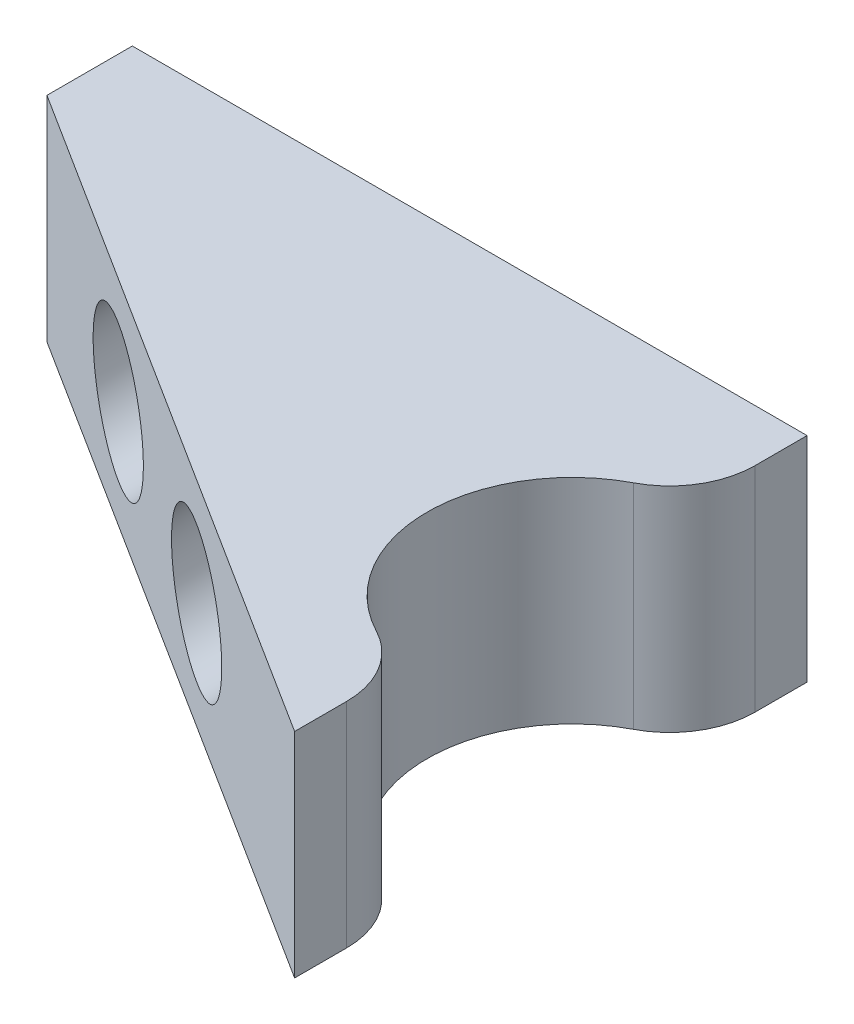
from build123d import *

# Parameters (mm, degrees)
SKETCH1_W           = 50.165
SKETCH1_H           = 15.875
SKETCH1_R           = 3.302
BOSS_EXTRUDE1_DEPTH = 6.35
BOSS_EXTRUDE2_DEPTH = 15.875
FILLET1_R           = 6.35
SKETCH1_3_R         = 3.302
CUT_EXTRUDE1_DEPTH  = 47.300601643
SKETCH10_R          = 5.08
CUT_EXTRUDE4_DEPTH  = 42.233459866


with BuildPart() as part:
    # Sketch1 → Boss-Extrude1 (new body)
    with BuildSketch(Plane.XY):
        Rectangle(SKETCH1_W, SKETCH1_H)
        with Locations((5.23875, 0)):
            Circle(SKETCH1_R, mode=Mode.SUBTRACT)
        with Locations((-10.63625, 0)):
            Circle(SKETCH1_R, mode=Mode.SUBTRACT)
    extrude(amount=BOSS_EXTRUDE1_DEPTH)

    # Sketch4 → Boss-Extrude2 (add, through all)
    with BuildSketch(Plane.XZ.offset(7.9375)):
        with BuildLine():
            Line((-25.0825, 6.35), (25.0825, 6.35))
            Line((25.0825, 6.35), (25.0825, 8.382))
            ThreePointArc((25.0825, 8.382), (15.884529206, 19.05), (25.0825, 29.718))
            Line((25.0825, 29.718), (25.0825, 38.1))
            Line((25.0825, 38.1), (-25.0825, 6.35))
        make_face()
    extrude(amount=-BOSS_EXTRUDE2_DEPTH)

    # Fillet1
    fillet1_edges = [part.edges().sort_by_distance(p)[0] for p in [
        (25.0825, 0, 8.382),
        (25.0825, 0, 29.718),
    ]]
    fillet(fillet1_edges, radius=FILLET1_R)

    # Sketch1<3> → Cut-Extrude1 (cut, through all)
    with BuildSketch(Plane.XY):
        with Locations(Location((5.23875, 0, 0), (0, 0, 180))):
            Circle(SKETCH1_3_R)
        with Locations(Location((-10.63625, 0, 0), (0, 0, 180))):
            Circle(SKETCH1_3_R)
    extrude(amount=CUT_EXTRUDE1_DEPTH, mode=Mode.SUBTRACT)

    # Sketch10 → Cut-Extrude4 (cut, through all)
    with BuildSketch(Plane(origin=(0, 0, 6.35), x_dir=(-1, 0, 0), z_dir=(0, 0, -1))):
        with Locations((10.63625, 0)):
            Circle(SKETCH10_R)
        with Locations((-5.23875, 0)):
            Circle(SKETCH10_R)
    extrude(amount=-CUT_EXTRUDE4_DEPTH, mode=Mode.SUBTRACT)


solid = part.part
